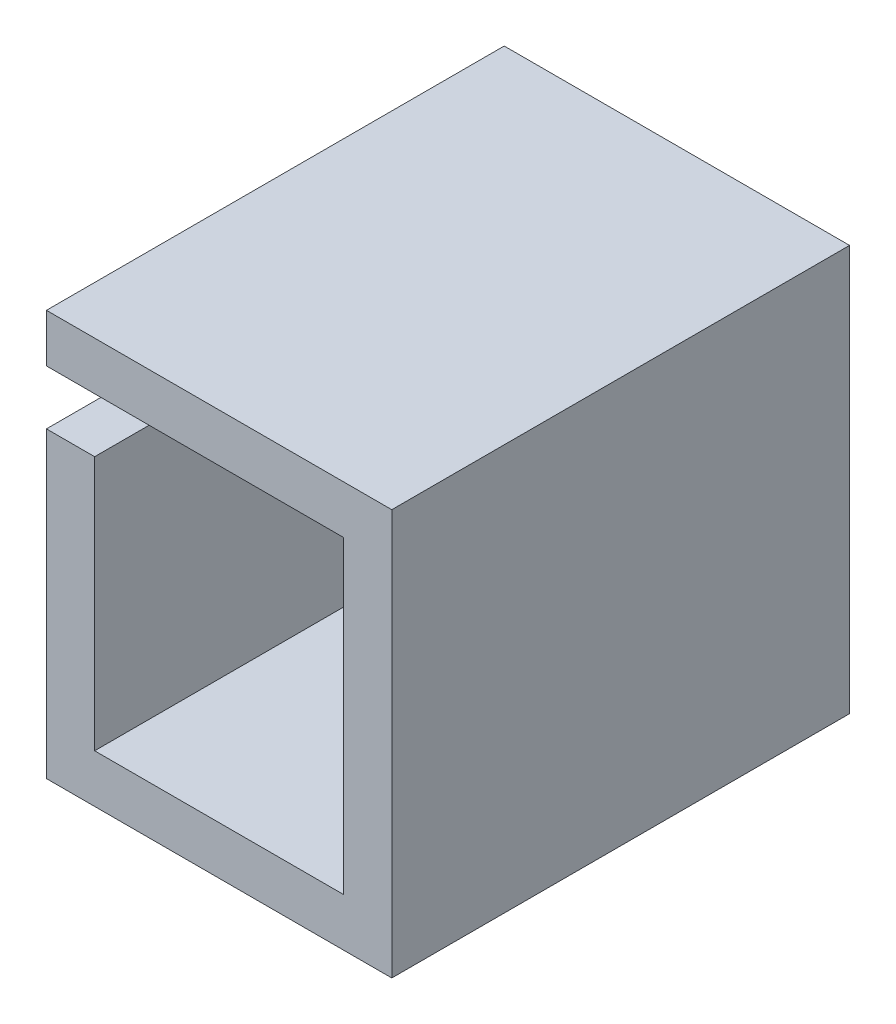
from build123d import *

# Parameters (mm, degrees)
BOSS_EXTRUDE1_DEPTH = 25.5
SKETCH2_W           = 21.5
SKETCH2_H           = 25.25
BOSS_EXTRUDE2_DEPTH = 3


with BuildPart() as part:
    # Sketch1 → Boss-Extrude1 (new body)
    with BuildSketch(Plane.XY):
        Polygon((-14.857142857, 10), (6.642857143, 10), (6.642857143, -15.25), (-14.857142857, -15.25), (-14.857142857, 3.607142857), (-11.857142857, 3.607142857), (-11.857142857, -12.25), (3.642857143, -12.25), (3.642857143, 7), (-14.857142857, 7), align=None)
    extrude(amount=BOSS_EXTRUDE1_DEPTH)

    # Sketch2 → Boss-Extrude2 (add)
    with BuildSketch(Plane(origin=(0, 0, 0), x_dir=(-1, 0, 0), z_dir=(0, 0, -1))):
        with Locations((4.107142857, -2.625)):
            Rectangle(SKETCH2_W, SKETCH2_H)
    extrude(amount=BOSS_EXTRUDE2_DEPTH)


solid = part.part
